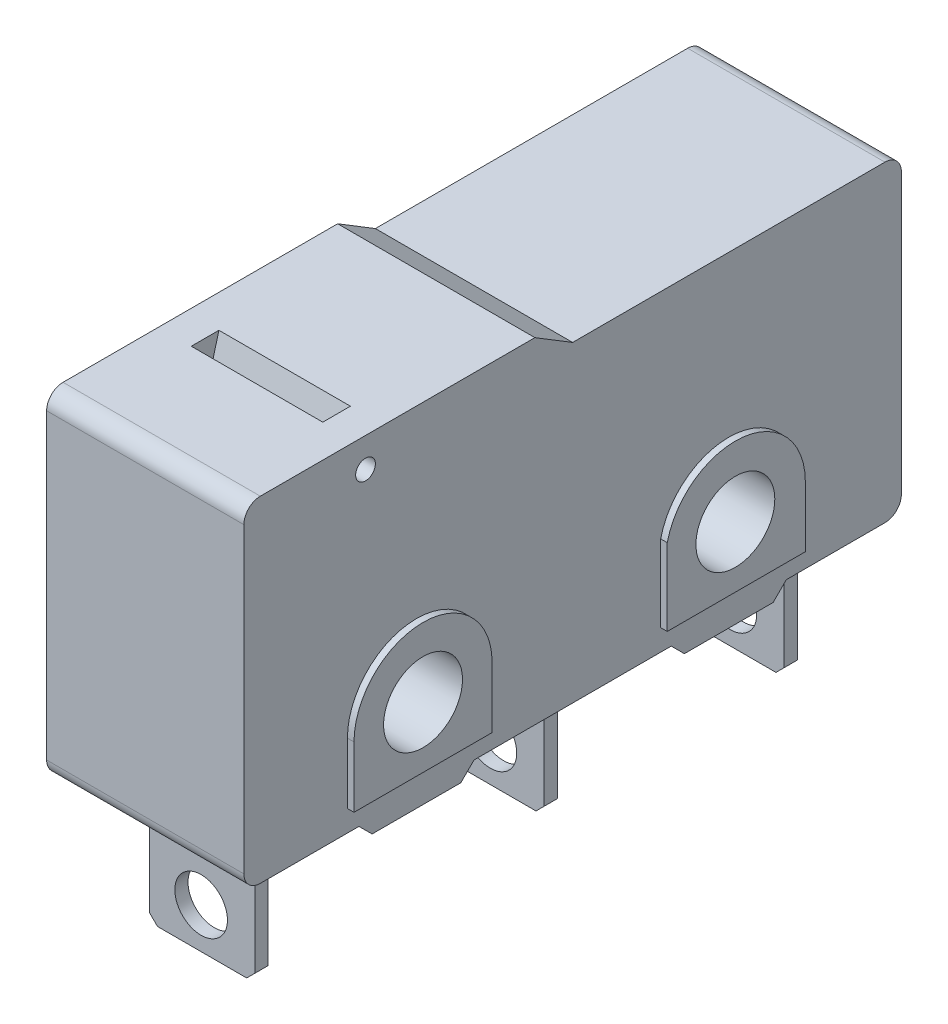
from build123d import *

# Parameters (mm, degrees)
BOSS_EXTRUDE1_DEPTH      = 3
SKETCH5_W                = 3.213765407
SKETCH5_H                = 0.4
BOSS_EXTRUDE2_DEPTH      = 3.9
CHAMFER2_SIZE            = 0.25
SKETCH6_R                = 0.8
CUT_EXTRUDE1_DEPTH       = 21.612860064
FILLET1_R                = 0.5
SKETCH7_R                = 1.2
CUT_EXTRUDE2_DEPTH       = 15.730919863
BOSS_EXTRUDE5_DEPTH      = 3.2
BOSS_EXTRUDE5_DEPTH_BACK = 3.4
SKETCH11_R               = 1.2
SKETCH12_R               = 0.3
CUT_EXTRUDE3_DEPTH       = 15.898322053
CUT_EXTRUDE4_DEPTH       = 2
CUT_EXTRUDE4_DEPTH_BACK  = 2


with BuildPart() as part:
    # Sketch1 → Boss-Extrude1 (new, symmetric)
    with BuildSketch(Plane(origin=(0, 0, 0), x_dir=(0, 0, -1), z_dir=(1, 0, 0))):
        Polygon((10, 4.4), (0, 4.4), (-1.147622848, 5.1), (-10, 5.1), (-10, -5.1), (-6.5, -5.1), (-6.1, -5.5), (-3.4, -5.5), (-3, -5.1), (3, -5.1), (3.4, -5.5), (6.1, -5.5), (6.5, -5.1), (10, -5.1), align=None)
    extrude(amount=BOSS_EXTRUDE1_DEPTH, both=True)

    # Sketch5 → Boss-Extrude2 (add)
    with BuildSketch(Plane.XZ.offset(5.1)):
        with Locations((0.02921605, 8.1)):
            Rectangle(SKETCH5_W, SKETCH5_H)
        with Locations((0.02921605, -0.7)):
            Rectangle(SKETCH5_W, SKETCH5_H)
        with Locations((0.02921605, -8)):
            Rectangle(SKETCH5_W, SKETCH5_H)
    extrude(amount=BOSS_EXTRUDE2_DEPTH)

    # Chamfer2
    chamfer2_edges = [part.edges().sort_by_distance(p)[0] for p in [
        (-1.577666654, -9, 8.1),
        (1.636098753, -9, 8.1),
        (-1.577666654, -9, -0.7),
        (1.636098753, -9, -0.7),
        (-1.577666654, -9, -8),
        (1.636098753, -9, -8),
    ]]
    chamfer(chamfer2_edges, length=CHAMFER2_SIZE)

    # Sketch6 → Cut-Extrude1 (cut, through all)
    with BuildSketch(Plane.XY.offset(8.3)):
        with Locations((0, -7.76874139)):
            Circle(SKETCH6_R)
    extrude(amount=-CUT_EXTRUDE1_DEPTH, mode=Mode.SUBTRACT)

    # Fillet1
    fillet1_edges = [part.edges().sort_by_distance(p)[0] for p in [
        (0, -5.1, 10),
        (0, 5.1, 10),
        (0, 4.4, -10),
        (0, -5.1, -10),
    ]]
    fillet(fillet1_edges, radius=FILLET1_R)

    # Sketch7 → Cut-Extrude2 (cut, through all)
    with BuildSketch(Plane(origin=(3, 0, 0), x_dir=(0, 0, -1), z_dir=(1, 0, 0))):
        with Locations((-4.75, -2.6)):
            Circle(SKETCH7_R)
        with Locations((4.75, -2.6)):
            Circle(SKETCH7_R)
    extrude(amount=-CUT_EXTRUDE2_DEPTH, mode=Mode.SUBTRACT)

    # Sketch11 → Boss-Extrude5 (add, two sides: drawn at the far end of the back side and taken through both)
    # profile 1 of 2: a face of its own
    with BuildSketch(Plane(origin=(0, 0, 0), x_dir=(0, 0, -1), z_dir=(1, 0, 0)).offset(-BOSS_EXTRUDE5_DEPTH_BACK)):
        with BuildLine():
            Line((-6.85, -4.453368072), (-2.65, -4.453368072))
            Line((-2.65, -4.453368072), (-2.65, -2.6))
            ThreePointArc((-2.65, -2.6), (-4.75, -0.5), (-6.85, -2.6))
            Line((-6.85, -2.6), (-6.85, -4.453368072))
        make_face()
        with Locations((-4.75, -2.6)):
            Circle(SKETCH11_R, mode=Mode.SUBTRACT)
    # profile 2 of 2: a face of its own
    with BuildSketch(Plane(origin=(0, 0, 0), x_dir=(0, 0, -1), z_dir=(1, 0, 0)).offset(-BOSS_EXTRUDE5_DEPTH_BACK)):
        with BuildLine():
            Line((2.678191921, -4.453368072), (6.878191921, -4.453368072))
            Line((6.878191921, -4.453368072), (6.878191921, -2.6))
            ThreePointArc((6.878191921, -2.6), (4.994944522, -0.485951033), (2.678191921, -2.113366526))
            Line((2.678191921, -2.113366526), (2.678191921, -4.453368072))
        make_face()
        with Locations((4.75, -2.6)):
            Circle(SKETCH11_R, mode=Mode.SUBTRACT)
    extrude(amount=BOSS_EXTRUDE5_DEPTH + BOSS_EXTRUDE5_DEPTH_BACK)

    # Sketch12 → Cut-Extrude3 (cut, through all)
    with BuildSketch(Plane(origin=(3, 0, 0), x_dir=(0, 0, -1), z_dir=(1, 0, 0))):
        with Locations((-6.3, 4.201970351)):
            Circle(SKETCH12_R)
    extrude(amount=-CUT_EXTRUDE3_DEPTH, mode=Mode.SUBTRACT)

    # Sketch13 → Cut-Extrude4 (cut, two sides: drawn at the far end of the back side and taken through both)
    with BuildSketch(Plane(origin=(0, 0, 0), x_dir=(0, 0, -1), z_dir=(1, 0, 0)).offset(-CUT_EXTRUDE4_DEPTH_BACK)):
        Polygon((-6.6, 4.201970351), (-6.6, 5.1), (-5.759373681, 5.1), (-6, 4.201970351), align=None)
    extrude(amount=CUT_EXTRUDE4_DEPTH + CUT_EXTRUDE4_DEPTH_BACK, mode=Mode.SUBTRACT)


solid = part.part
